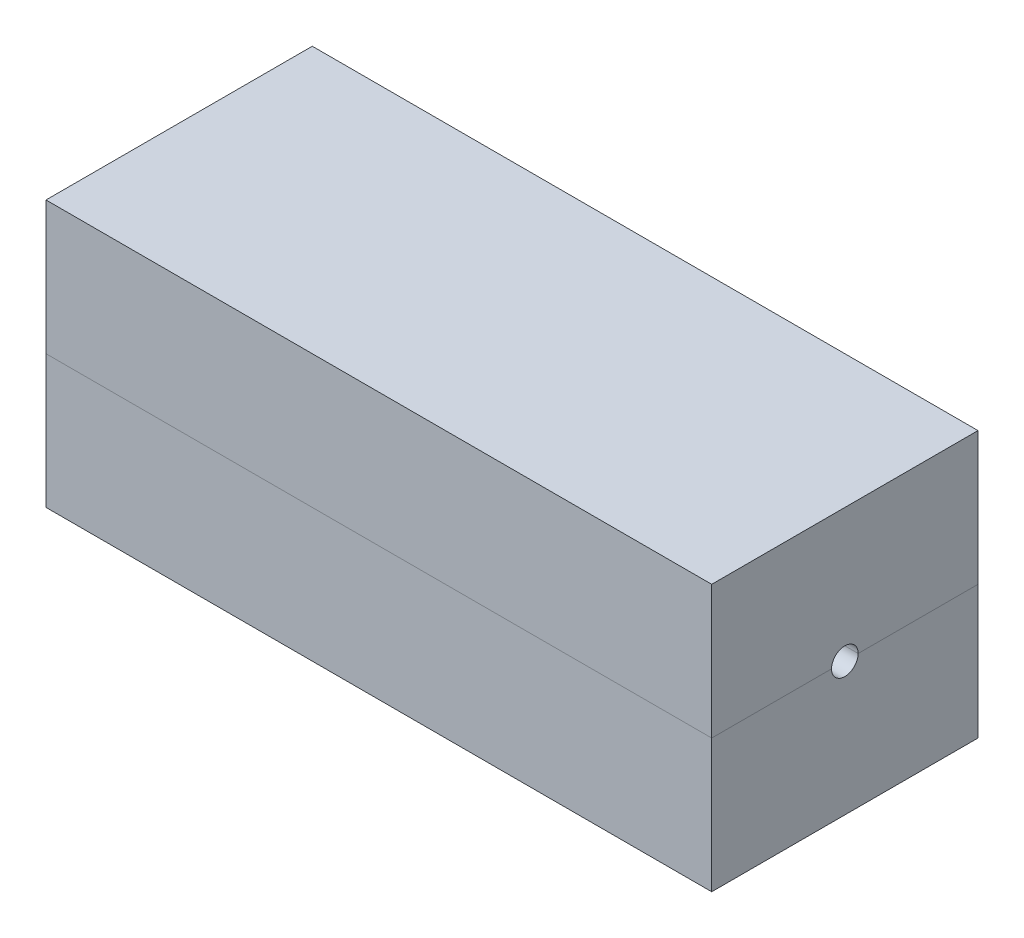
from build123d import *

# Parameters (mm, degrees)
SKETCH_1_W               = 100
SKETCH_1_H               = 40
EXTRUDE_1_DEPTH          = 40
CUT_EXTRUDE_1_DEPTH      = 7
CUT_EXTRUDE_1_DEPTH_BACK = 7
SKETCH_2_W               = 80
SKETCH_2_H               = 20
EXTRUDE_2_DEPTH          = 5
CUT_EXTRUDE_2_DEPTH      = 5
SKETCH_6_R               = 2
CUT_EXTRUDE_3_DEPTH      = 115.891252931
CUT_EXTRUDE_START        = -10
SKETCH_7_R               = 3
CUT_EXTRUDE_4_DEPTH      = 10


with BuildPart() as part:
    # ｽｹｯﾁ1 → ﾎﾞｽ - 押し出し1 (new body)
    with BuildSketch(Plane.XY):
        with Locations((50, 20)):
            Rectangle(SKETCH_1_W, SKETCH_1_H)
    extrude(amount=EXTRUDE_1_DEPTH)


with BuildPart() as body_2:
    # Split Bodies 1: the piece on the far side of the plane
    add(part.part)
    split(bisect_by=Plane.ZX.offset(20), keep=Keep.BOTTOM)


with BuildPart() as part_1:
    add(part.part)

    # Split Bodies 1
    split(bisect_by=Plane.ZX.offset(20), keep=Keep.TOP)


with BuildPart() as cut_extrude_1_tool:
    # ｽｹｯﾁ2 → ｶｯﾄ - 押し出し1 (new, two sides: drawn at the far end of the back side and taken through both)
    with BuildSketch(Plane(origin=(0, 20, 0), x_dir=(1, 0, 0), z_dir=(0, 1, 0)).offset(-CUT_EXTRUDE_1_DEPTH_BACK)):
        with Locations((50, -20)):
            Rectangle(SKETCH_2_W, SKETCH_2_H)
    extrude(amount=CUT_EXTRUDE_1_DEPTH + CUT_EXTRUDE_1_DEPTH_BACK)


with BuildPart() as part_2:
    add(part_1.part)

    # ｶｯﾄ - 押し出し1: cut by cut_extrude_1_tool
    add(cut_extrude_1_tool.part, mode=Mode.SUBTRACT)

    # ｽｹｯﾁ4 → ｶｯﾄ - 押し出し2 (cut)
    with BuildSketch(Plane.XZ.offset(-20)):
        Polygon((92.3, 32.3), (92.3, 24.5), (97.7, 24.5), (97.7, 37.7), (2.3, 37.7), (2.3, 24.5), (7.7, 24.5), (7.7, 32.3), align=None)
        Polygon((7.7, 7.7), (92.3, 7.7), (92.3, 15.5), (97.7, 15.5), (97.7, 2.3), (2.3, 2.3), (2.3, 15.5), (7.7, 15.5), align=None)
    extrude(amount=-CUT_EXTRUDE_2_DEPTH, mode=Mode.SUBTRACT)


with BuildPart() as body_2_1:
    add(body_2.part)

    # ｶｯﾄ - 押し出し1: cut by cut_extrude_1_tool
    add(cut_extrude_1_tool.part, mode=Mode.SUBTRACT)

    # ｽｹｯﾁ3 → ﾎﾞｽ - 押し出し2 (add)
    with BuildSketch(Plane(origin=(0, 20, 0), x_dir=(1, 0, 0), z_dir=(0, 1, 0))):
        Polygon((7.5, -32.5), (92.5, -32.5), (92.5, -25), (97.5, -25), (97.5, -37.5), (2.5, -37.5), (2.5, -25), (7.5, -25), align=None)
        Polygon((7.5, -7.5), (92.5, -7.5), (92.5, -15), (97.5, -15), (97.5, -2.5), (2.5, -2.5), (2.5, -15), (7.5, -15), align=None)
    extrude(amount=EXTRUDE_2_DEPTH)


with BuildPart() as cut_extrude_3_tool:
    # ｽｹｯﾁ6 → ｶｯﾄ - 押し出し3 (new, through all)
    with BuildSketch(Plane.ZY):
        with Locations((20, 20)):
            Circle(SKETCH_6_R)
    extrude(amount=-CUT_EXTRUDE_3_DEPTH)


with BuildPart() as part_3:
    add(part_2.part)

    # ｶｯﾄ - 押し出し3: cut by cut_extrude_3_tool
    add(cut_extrude_3_tool.part, mode=Mode.SUBTRACT)


with BuildPart() as body_2_2:
    add(body_2_1.part)

    # ｶｯﾄ - 押し出し3: cut by cut_extrude_3_tool
    add(cut_extrude_3_tool.part, mode=Mode.SUBTRACT)


with BuildPart() as cut_extrude_4_tool:
    # ｽｹｯﾁ7 → ｶｯﾄ - 押し出し4 (new body)
    with BuildSketch(Plane.ZY.offset(CUT_EXTRUDE_START)):
        with Locations((20, 20)):
            Circle(SKETCH_7_R)
    extrude(amount=CUT_EXTRUDE_4_DEPTH)


with BuildPart() as part_4:
    add(part_3.part)

    # ｶｯﾄ - 押し出し4: cut by cut_extrude_4_tool
    add(cut_extrude_4_tool.part, mode=Mode.SUBTRACT)


with BuildPart() as body_2_3:
    add(body_2_2.part)

    # ｶｯﾄ - 押し出し4: cut by cut_extrude_4_tool
    add(cut_extrude_4_tool.part, mode=Mode.SUBTRACT)


solid = Compound([part_4.part, body_2_3.part])
